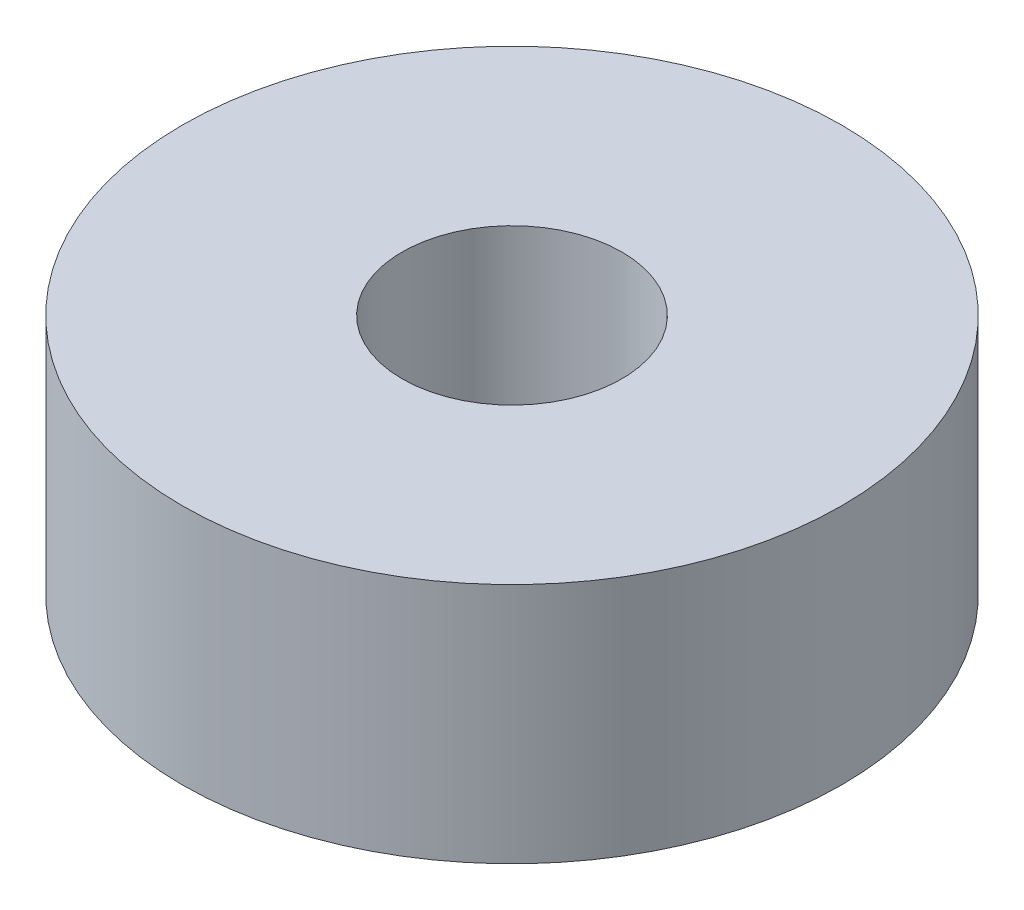
from build123d import *

# Parameters (mm, degrees)
SKETCH1_R           = 19.05
SKETCH1_R_2         = 6.35
BOSS_EXTRUDE1_DEPTH = 13.97


with BuildPart() as part:
    # Sketch1 → Boss-Extrude1 (new body)
    with BuildSketch(Plane(origin=(0, 0, 0), x_dir=(1, 0, 0), z_dir=(0, 1, 0))):
        with Locations(Location((0, 0, 0), (0, 0, 270))):
            Circle(SKETCH1_R)
        with Locations(Location((0, 0, 0), (0, 0, 270))):
            Circle(SKETCH1_R_2, mode=Mode.SUBTRACT)
    extrude(amount=BOSS_EXTRUDE1_DEPTH)


solid = part.part
